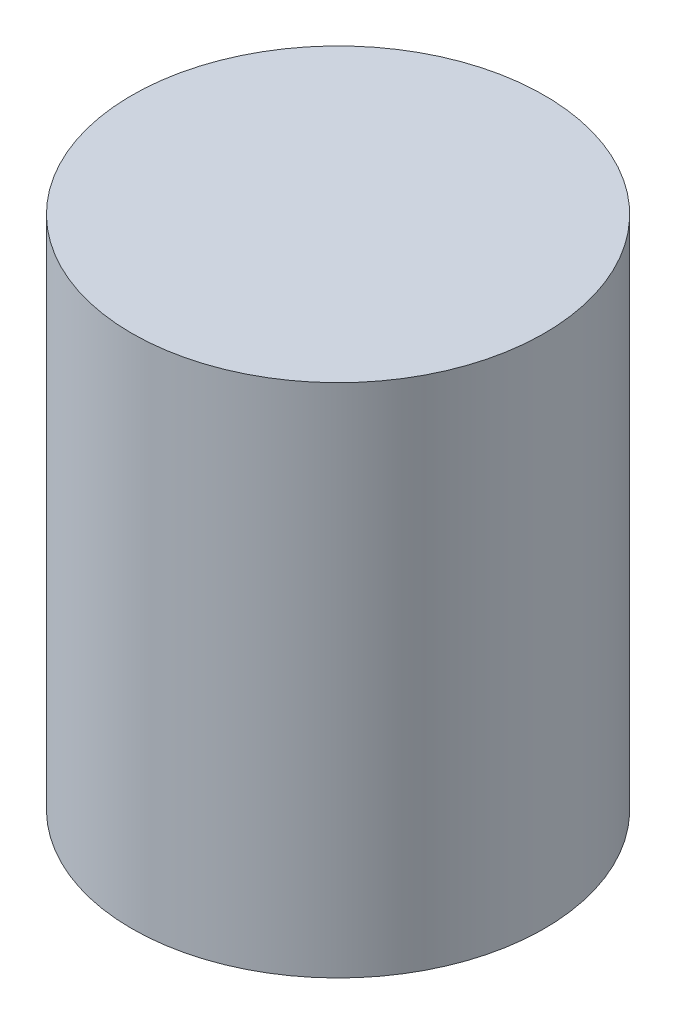
from build123d import *

# Parameters (mm, degrees)
SKETCH1_R           = 400
BOSS_EXTRUDE2_DEPTH = 500


with BuildPart() as part:
    # Sketch1 → Boss-Extrude2 (new, symmetric)
    with BuildSketch(Plane(origin=(0, 0, 0), x_dir=(1, 0, 0), z_dir=(0, 1, 0))):
        with Locations(Location((0, 0, 0), (0, 0, 270))):
            Circle(SKETCH1_R)
    extrude(amount=BOSS_EXTRUDE2_DEPTH, both=True)


solid = part.part
